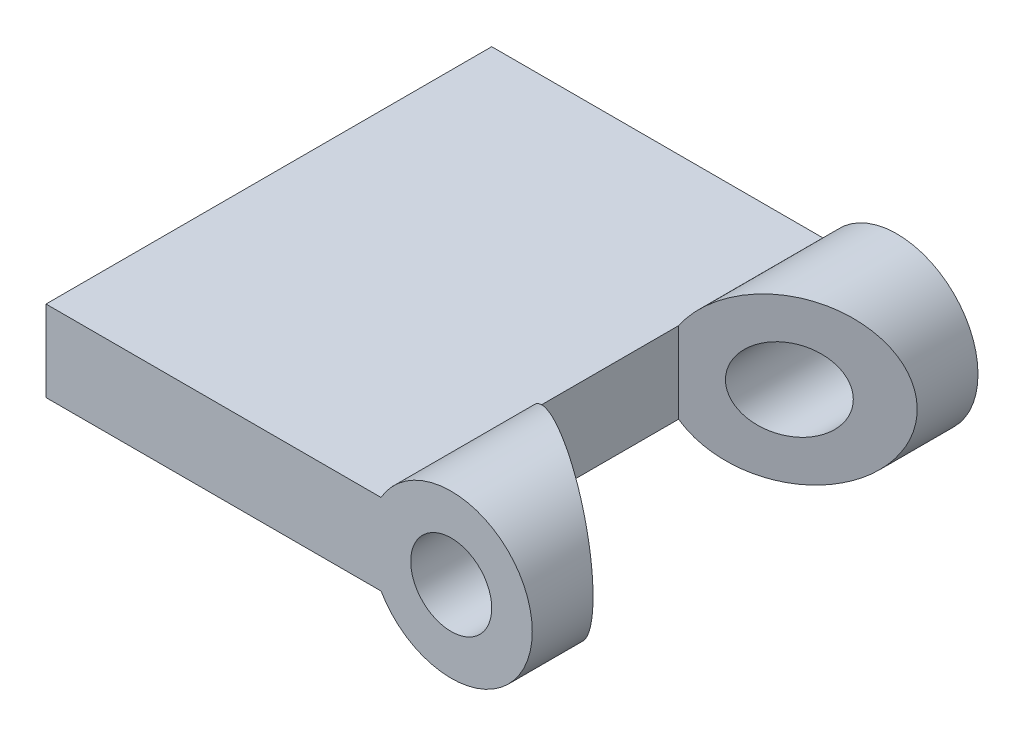
from build123d import *

# Parameters (mm, degrees)
SKETCH_1_R               = 20
EXTRUDE_1_DEPTH          = 55
SKETCH_2_W               = 100
SKETCH_2_H               = 110
EXTRUDE_2_DEPTH          = 10
SKETCH_3_R               = 10
CUT_EXTRUDE_1_DEPTH      = 151
CUT_EXTRUDE_3_DEPTH      = 119.004237212
CUT_EXTRUDE_3_DEPTH_BACK = 119.004237212


with BuildPart() as part:
    # 草图1 → 凸台-拉伸1 (new, symmetric)
    with BuildSketch(Plane.XY):
        Circle(SKETCH_1_R)
    extrude(amount=EXTRUDE_1_DEPTH, both=True)

    # 草图2 → 凸台-拉伸2 (add, symmetric)
    with BuildSketch(Plane(origin=(0, 0, 0), x_dir=(1, 0, 0), z_dir=(0, 1, 0))):
        with Locations((-50, 0)):
            Rectangle(SKETCH_2_W, SKETCH_2_H)
    extrude(amount=EXTRUDE_2_DEPTH, both=True)

    # 草图3 → 切除-拉伸1 (cut, through all)
    with BuildSketch(Plane.XY.offset(55)):
        Circle(SKETCH_3_R)
    extrude(amount=-CUT_EXTRUDE_1_DEPTH, mode=Mode.SUBTRACT)

    # 草图5 → 切除-拉伸3 (cut, two sides: drawn at the far end of the back side and taken through both)
    with BuildSketch(Plane(origin=(0, 10, 0), x_dir=(1, 0, 0), z_dir=(0, 1, 0)).offset(-CUT_EXTRUDE_3_DEPTH_BACK)):
        Polygon((20, -40), (-17.320508076, -18.452994616), (-17.320508076, 18.452994616), (20, 40), align=None)
    extrude(amount=CUT_EXTRUDE_3_DEPTH + CUT_EXTRUDE_3_DEPTH_BACK, mode=Mode.SUBTRACT)


solid = part.part
